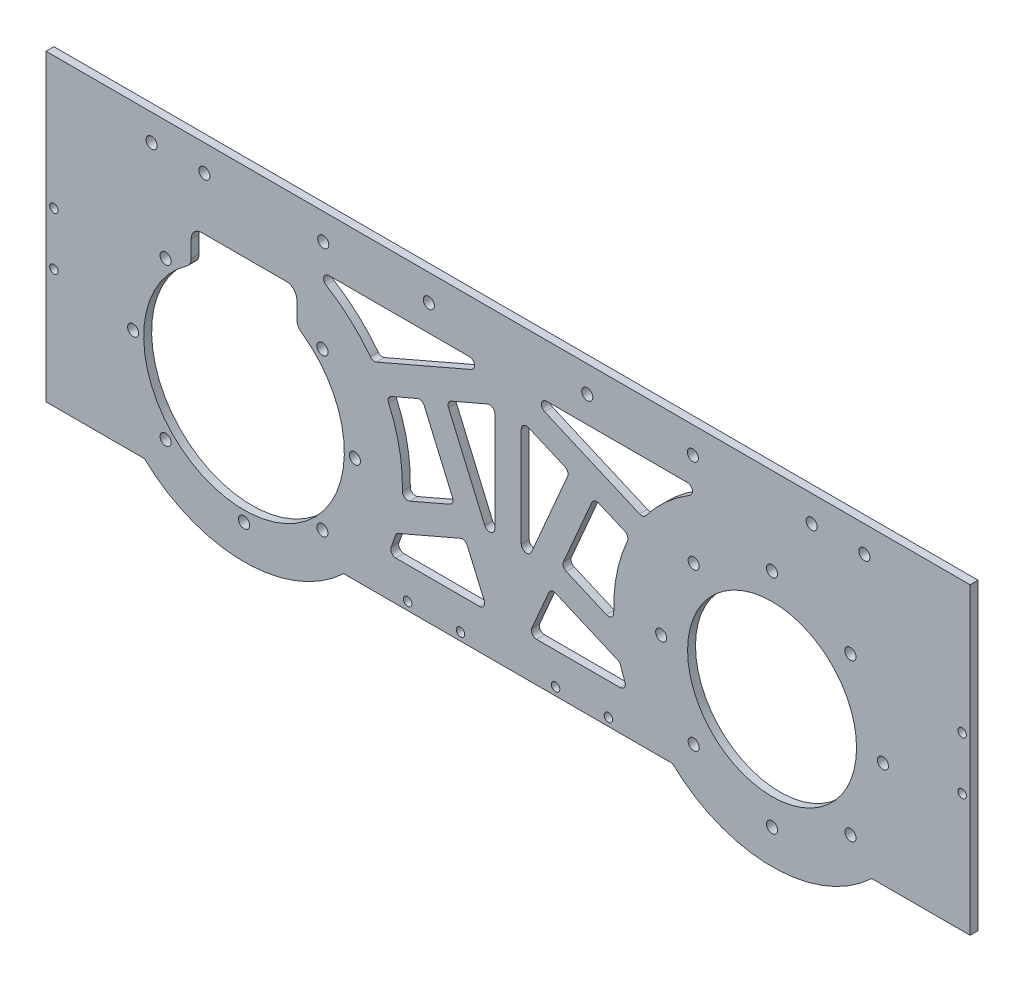
from build123d import *

# Parameters (mm, degrees)
SKETCH_1_W              = 350
SKETCH_1_H              = 130
EXTRUDE_1_DEPTH         = 3
SKETCH_2_R              = 2.1
CUT_EXTRUDE_1_DEPTH     = 191.417961338
SKETCH_3_R              = 32
SKETCH_3_R_2            = 38
CUT_EXTRUDE_3_DEPTH     = 10
SKETCH_4_W              = 40
SKETCH_4_H              = 15
CUT_EXTRUDE_4_DEPTH     = 191.417961338
HOLE_WIZARD_4_2_4_2_1_D = 4.2
HOLE_WIZARD_3_2_3_2_2_D = 3.2
CUT_EXTRUDE_5_DEPTH     = 191.417961338
CUT_EXTRUDE_6_DEPTH     = 191.417961338
FILLET_1_R              = 4
CUT_EXTRUDE_7_DEPTH     = 191.417961338
FILLET_2_R              = 2
FILLET_2_OF_MIRROR_4_R  = 2
HOLE_WIZARD_3_2_3_2_3_D = 3.2


with BuildPart() as part:
    # 草图1 → 凸台-拉伸1 (new body)
    with BuildSketch(Plane.XY):
        with Locations((0, 10)):
            Rectangle(SKETCH_1_W, SKETCH_1_H)
    extrude(amount=EXTRUDE_1_DEPTH)

    # 草图2 → 切除-拉伸1 (cut, through all)
    with BuildSketch(Plane(origin=(0, 0, 0), x_dir=(-1, 0, 0), z_dir=(0, 0, -1))):
        with Locations((-100, 42)):
            Circle(SKETCH_2_R)
        with Locations((-70.30151519, 29.69848481)):
            Circle(SKETCH_2_R)
        with Locations((-58, 0)):
            Circle(SKETCH_2_R)
        with Locations((-70.30151519, -29.69848481)):
            Circle(SKETCH_2_R)
        with Locations((-100, -42)):
            Circle(SKETCH_2_R)
        with Locations((-129.69848481, -29.69848481)):
            Circle(SKETCH_2_R)
        with Locations((-142, 0)):
            Circle(SKETCH_2_R)
        with Locations((-129.69848481, 29.69848481)):
            Circle(SKETCH_2_R)
        with Locations(Location((129.69848481, 29.69848481, 0), (0, 0, 180))):
            Circle(SKETCH_2_R)
        with Locations(Location((142, 0, 0), (0, 0, 180))):
            Circle(SKETCH_2_R)
        with Locations(Location((129.69848481, -29.69848481, 0), (0, 0, 180))):
            Circle(SKETCH_2_R)
        with Locations(Location((100, -42, 0), (0, 0, 180))):
            Circle(SKETCH_2_R)
        with Locations(Location((70.30151519, -29.69848481, 0), (0, 0, 180))):
            Circle(SKETCH_2_R)
        with Locations(Location((58, 0, 0), (0, 0, 180))):
            Circle(SKETCH_2_R)
        with Locations(Location((70.30151519, 29.69848481, 0), (0, 0, 180))):
            Circle(SKETCH_2_R)
        with Locations(Location((100, 42, 0), (0, 0, 180))):
            Circle(SKETCH_2_R)
    extrude(amount=-CUT_EXTRUDE_1_DEPTH, mode=Mode.SUBTRACT)

    # 草图3 → 切除-拉伸3 (cut)
    with BuildSketch(Plane(origin=(0, 0, 0), x_dir=(-1, 0, 0), z_dir=(0, 0, -1))):
        with Locations((-100, 0)):
            Circle(SKETCH_3_R)
        with Locations((100, 0)):
            Circle(SKETCH_3_R_2)
    extrude(amount=-CUT_EXTRUDE_3_DEPTH, mode=Mode.SUBTRACT)

    # 草图4 → 切除-拉伸4 (cut, through all)
    with BuildSketch(Plane(origin=(0, 0, 0), x_dir=(-1, 0, 0), z_dir=(0, 0, -1))):
        with Locations((100, 37.5)):
            Rectangle(SKETCH_4_W, SKETCH_4_H)
    extrude(amount=-CUT_EXTRUDE_4_DEPTH, mode=Mode.SUBTRACT)

    # Ø4.2 (4.2) 直径孔1 (through all)
    with Locations(Plane(origin=(-30, 65, 3), x_dir=(1, 0, 0), z_dir=(0, 0, 1))):
        with Locations((0, 0), (-40, 0), (-85, 0), (-105, 0)):
            hole_wizard_4_2_4_2_1 = Hole(HOLE_WIZARD_4_2_4_2_1_D / 2)

    # 镜向1: Ø4.2 (4.2) 直径孔1 across plane
    add(hole_wizard_4_2_4_2_1.mirror(Plane(origin=(0, 0, 0), x_dir=(0, 0, 1), z_dir=(1, 0, 0))), mode=Mode.SUBTRACT)

    # Ø3.2 (3.2) 直径孔2 (through all)
    with Locations(Plane(origin=(-172, 25, 3), x_dir=(1, 0, 0), z_dir=(0, 0, 1))):
        with Locations((0, 0), (0, -20)):
            hole_wizard_3_2_3_2_2 = Hole(HOLE_WIZARD_3_2_3_2_2_D / 2)

    # 镜向3: Ø3.2 (3.2) 直径孔2 across plane
    add(hole_wizard_3_2_3_2_2.mirror(Plane(origin=(0, 0, 0), x_dir=(0, 0, 1), z_dir=(1, 0, 0))), mode=Mode.SUBTRACT)

    # 草图12 → 切除-拉伸5 (cut, through all)
    with BuildSketch(Plane.XY.offset(3)):
        with BuildLine():
            Line((-175, -55), (-100, -55))
            ThreePointArc((-100, -55), (-120.310096012, -51.112620751), (-137.749172176, -40))
            Line((-137.749172176, -40), (-175, -40))
            Line((-175, -40), (-175, -55))
        make_face()
        with BuildLine():
            Line((175, -55), (175, -40))
            Line((175, -40), (137.749172176, -40))
            ThreePointArc((137.749172176, -40), (120.310096012, -51.112620751), (100, -55))
            Line((100, -55), (175, -55))
        make_face()
    extrude(amount=-CUT_EXTRUDE_5_DEPTH, mode=Mode.SUBTRACT)

    # 草图14 → 切除-拉伸6 (cut, through all)
    with BuildSketch(Plane.XY.offset(3)):
        with BuildLine():
            Line((-62.250827824, -40), (62.250827824, -40))
            ThreePointArc((62.250827824, -40), (79.689903988, -51.112620751), (100, -55))
            Line((100, -55), (-100, -55))
            ThreePointArc((-100, -55), (-79.689903988, -51.112620751), (-62.250827824, -40))
        make_face()
    extrude(amount=-CUT_EXTRUDE_6_DEPTH, mode=Mode.SUBTRACT)

    # 圆角1
    fillet_1_edges = [part.edges().sort_by_distance(p)[0] for p in [
        (-120, 45, 1.5),
        (-80, 45, 1.5),
        (-120, 32.310988843, 1.5),
        (-80, 32.310988843, 1.5),
    ]]
    fillet(fillet_1_edges, radius=FILLET_1_R)

    # 草图16 → 切除-拉伸7 (cut, through all)
    with BuildSketch(Plane.XY.offset(3)):
        with BuildLine():
            Line((76.020842383, 55), (5, 55))
            Line((5, 55), (51.266028276, 35))
            ThreePointArc((51.266028276, 35), (62.293239404, 46.671192457), (76.020842383, 55))
        make_face()
        with BuildLine():
            Line((46.091915187, 26.342330797), (32.537213763, 32.201792665))
            Line((32.537213763, 32.201792665), (20.206140943, 3.676304477))
            Line((20.206140943, 3.676304477), (40.206140943, -4.969347957))
            ThreePointArc((40.206140943, -4.969347957), (41.032735212, 11.084298962), (46.091915187, 26.342330797))
        make_face()
        Polygon((5, 44.105651626), (5, -6.298171369), (23.358142509, 36.169745652), align=None)
        with BuildLine():
            Line((42.404028194, -16.813804795), (16.238187957, -5.502766777))
            Line((16.238187957, -5.502766777), (7.809872863, -25))
            Line((7.809872863, -25), (45.456439427, -25))
            ThreePointArc((45.456439427, -25), (43.781034085, -20.962534948), (42.404028194, -16.813804795))
        make_face()
    cut_extrude_7 = extrude(amount=-CUT_EXTRUDE_7_DEPTH, mode=Mode.SUBTRACT)

    # 圆角2
    fillet_2_edges = [part.edges().sort_by_distance(p)[0] for p in [
        (42.404028194, -16.813804795, 1.5),
        (45.456439427, -25, 1.5),
        (7.809872863, -25, 1.5),
        (16.238187957, -5.502766777, 1.5),
        (20.206140943, 3.676304477, 1.5),
        (32.537213763, 32.201792665, 1.5),
        (46.091915187, 26.342330797, 1.5),
        (40.206140943, -4.969347957, 1.5),
        (5, 44.105651626, 1.5),
        (23.358142509, 36.169745652, 1.5),
        (5, -6.298171369, 1.5),
        (51.266028276, 35, 1.5),
        (5, 55, 1.5),
        (76.020842383, 55, 1.5),
    ]]
    fillet(fillet_2_edges, radius=FILLET_2_R)

    # 镜向4: 切除-拉伸7 across plane
    add(cut_extrude_7.mirror(Plane(origin=(0, 0, 0), x_dir=(0, 0, 1), z_dir=(1, 0, 0))), mode=Mode.SUBTRACT)

    # 圆角2 of 镜向4
    fillet_2_of_mirror_4_edges = [part.edges().sort_by_distance(p)[0] for p in [
        (-42.404028194, -16.813804795, 1.5),
        (-45.456439427, -25, 1.5),
        (-7.809872863, -25, 1.5),
        (-16.238187957, -5.502766777, 1.5),
        (-20.206140943, 3.676304477, 1.5),
        (-32.537213763, 32.201792665, 1.5),
        (-46.091915187, 26.342330797, 1.5),
        (-40.206140943, -4.969347957, 1.5),
        (-5, 44.105651626, 1.5),
        (-23.358142509, 36.169745652, 1.5),
        (-5, -6.298171369, 1.5),
        (-51.266028276, 35, 1.5),
        (-5, 55, 1.5),
        (-76.020842383, 55, 1.5),
    ]]
    fillet(fillet_2_of_mirror_4_edges, radius=FILLET_2_OF_MIRROR_4_R)

    # Ø3.2 (3.2) 直径孔3 (through all)
    with Locations(Plane(origin=(18, -37, 3), x_dir=(1, 0, 0), z_dir=(0, 0, 1))):
        with Locations((0, 0), (20, 0)):
            hole_wizard_3_2_3_2_3 = Hole(HOLE_WIZARD_3_2_3_2_3_D / 2)

    # 镜向5: Ø3.2 (3.2) 直径孔3 across plane
    add(hole_wizard_3_2_3_2_3.mirror(Plane(origin=(0, 0, 0), x_dir=(0, 0, 1), z_dir=(1, 0, 0))), mode=Mode.SUBTRACT)


solid = part.part
